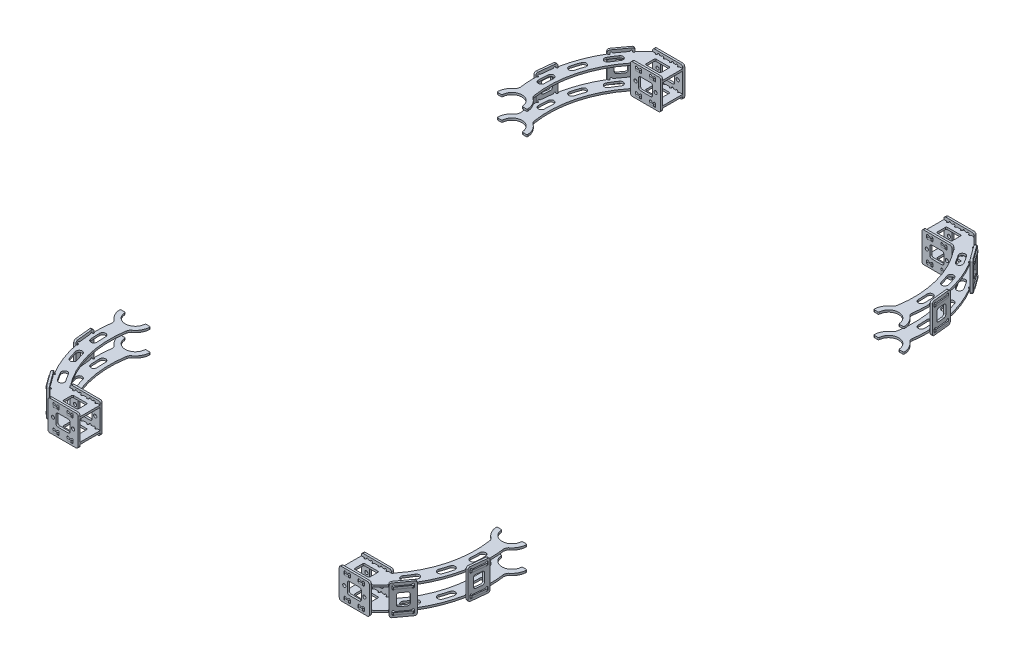
from build123d import *

# Parameters (mm, degrees)
EXTRUDE_START       = 10
SKETCH_1_W          = 15
SKETCH_1_H          = 10
EXTRUDE_1_DEPTH     = 2
SKETCH_2_R          = 1
CUT_EXTRUDE_1_DEPTH = 130.036816452
CHAMFER_1_SIZE      = 1
FILLET_1_R          = 5
FILLET_5_R          = 1
SKETCH_3_W          = 30
SKETCH_3_H          = 30
SKETCH_3_R          = 1.6
SKETCH_3_W_2        = 14
SKETCH_3_H_2        = 12
EXTRUDE_2_DEPTH     = 2
FILLET_2_R          = 2
EXTRUDE_START_2     = -1
SKETCH_4_W          = 20
SKETCH_4_H          = 30
SKETCH_4_W_2        = 10
SKETCH_4_H_2        = 12
EXTRUDE_3_DEPTH     = 2
FILLET_3_R          = 2
SKETCH_5_W          = 20
SKETCH_5_H          = 30
SKETCH_5_W_2        = 10
SKETCH_5_H_2        = 12
EXTRUDE_4_DEPTH     = 2
FILLET_4_R          = 2


with BuildPart() as part:
    # 草图1 → 凸台-拉伸1 (new body)
    with BuildSketch(Plane(origin=(0, 0, 0), x_dir=(1, 0, 0), z_dir=(0, 1, 0)).offset(EXTRUDE_START)):
        with BuildLine():
            Line((-27.5, -92.5), (-30.5, -92.5))
            ThreePointArc((-30.5, -92.5), (-31.5, -93.5), (-32.5, -92.5))
            Line((-32.5, -92.5), (-32.5, -89.5))
            Line((-32.5, -89.5), (-38.5, -89.5))
            Line((-38.5, -89.5), (-38.5, -92.5))
            ThreePointArc((-38.5, -92.5), (-39.5, -93.5), (-40.5, -92.5))
            Line((-40.5, -92.5), (-44.5, -92.5))
            ThreePointArc((-44.5, -92.5), (-45.5, -93.5), (-46.5, -92.5))
            Line((-46.5, -92.5), (-46.5, -89.5))
            Line((-46.5, -89.5), (-52.5, -89.5))
            Line((-52.5, -89.5), (-52.5, -92.5))
            ThreePointArc((-52.5, -92.5), (-53.5, -93.5), (-54.5, -92.5))
            Line((-54.5, -92.5), (-57.5, -92.5))
            Line((-57.5, -92.5), (-57.5, -112.5))
            Line((-57.5, -112.5), (-54.5, -112.5))
            ThreePointArc((-54.5, -112.5), (-53.5, -111.5), (-52.5, -112.5))
            Line((-52.5, -112.5), (-52.5, -115.5))
            Line((-52.5, -115.5), (-46.5, -115.5))
            Line((-46.5, -115.5), (-46.5, -112.5))
            ThreePointArc((-46.5, -112.5), (-45.5, -111.5), (-44.5, -112.5))
            Line((-44.5, -112.5), (-40.5, -112.5))
            ThreePointArc((-40.5, -112.5), (-39.5, -111.5), (-38.5, -112.5))
            Line((-38.5, -112.5), (-38.5, -115.5))
            Line((-38.5, -115.5), (-32.5, -115.5))
            Line((-32.5, -115.5), (-32.5, -112.5))
            ThreePointArc((-32.5, -112.5), (-31.5, -111.5), (-30.5, -112.5))
            Line((-30.5, -112.5), (-27.5, -112.5))
            ThreePointArc((-27.5, -112.5), (-23.120698186, -108.257925136), (-18.981512523, -103.781249407))
            ThreePointArc((-18.981512523, -103.781249407), (-19.109539683, -102.403659075), (-17.738715012, -102.216614162))
            Line((-17.738715012, -102.216614162), (-15.01528498, -104.195301902))
            Line((-15.01528498, -104.195301902), (-5.610720943, -91.251029992))
            Line((-5.610720943, -91.251029992), (-8.334150976, -89.272342252))
            ThreePointArc((-8.334150976, -89.272342252), (-8.579868811, -87.910810459), (-7.230139981, -87.6068727))
            ThreePointArc((-7.230139981, -87.6068727), (1.053453635, -70.555329514), (6.307253335, -52.340757409))
            ThreePointArc((6.307253335, -52.340757409), (5.507583396, -51.211742766), (6.601229928, -50.364344784))
            Line((6.601229928, -50.364344784), (9.949133391, -50.716223617))
            Line((9.949133391, -50.716223617), (11.621588804, -34.803873291))
            Line((11.621588804, -34.803873291), (8.27368534, -34.451994458))
            ThreePointArc((8.27368534, -34.451994458), (7.380121556, -33.395732255), (8.397052132, -32.457650019))
            ThreePointArc((8.397052132, -32.457650019), (8.11616167, -22.831672104), (7, -13.266499161))
            ThreePointArc((7, -13.266499161), (12.845232579, -7.745966692), (15, 0))
            Line((15, 0), (10, 0))
            ThreePointArc((10, 0), (0, -10), (-10, 0))
            Line((-10, 0), (-15, 0))
            ThreePointArc((-15, 0), (-12.845232579, -7.745966692), (-7, -13.266499161))
            ThreePointArc((-7, -13.266499161), (-8.478220219, -55.1527629), (-27.5, -92.5))
        make_face()
        with Locations((-42.5, -102.5)):
            Rectangle(SKETCH_1_W, SKETCH_1_H, mode=Mode.SUBTRACT)
    extrude(amount=EXTRUDE_1_DEPTH)

    # 草图2 → 切除-拉伸1 (cut, through all)
    with BuildSketch(Plane(origin=(0, 12, 0), x_dir=(1, 0, 0), z_dir=(0, 1, 0))):
        with Locations((-27.5, -91.5)):
            Circle(SKETCH_2_R)
        with BuildLine():
            ThreePointArc((4.26643825, -40.197188362), (4.571765263, -35.538798336), (4.673605554, -30.871523888))
            ThreePointArc((4.673605554, -30.871523888), (1.673605554, -27.871523888), (-1.326394446, -30.871523888))
            ThreePointArc((-1.326394446, -30.871523888), (-1.422524066, -35.277082012), (-1.710729939, -39.674253905))
            ThreePointArc((-1.710729939, -39.674253905), (1.016386927, -42.924305228), (4.26643825, -40.197188362))
        make_face()
        with BuildLine():
            ThreePointArc((-7.417439746, -65.415558364), (-6.00098242, -61.242809638), (-4.767885991, -57.012247443))
            ThreePointArc((-4.767885991, -57.012247443), (-1.093651376, -54.8909271), (1.027668967, -58.565161714))
            ThreePointArc((1.027668967, -58.565161714), (-0.278680716, -63.047044435), (-1.779284022, -67.467679224))
            ThreePointArc((-1.779284022, -67.467679224), (-5.624422314, -69.260696656), (-7.417439746, -65.415558364))
        make_face()
        with BuildLine():
            ThreePointArc((-19.592037973, -88.802743959), (-17.143858419, -85.138784331), (-14.857828664, -81.371523888))
            ThreePointArc((-14.857828664, -81.371523888), (-10.759752452, -80.273447677), (-9.661676241, -84.371523888))
            ThreePointArc((-9.661676241, -84.371523888), (-12.083509744, -88.362581981), (-14.677125707, -92.244202577))
            ThreePointArc((-14.677125707, -92.244202577), (-18.855311149, -92.980929401), (-19.592037973, -88.802743959))
        make_face()
    extrude(amount=-CUT_EXTRUDE_1_DEPTH, mode=Mode.SUBTRACT)

    # 倒角1
    chamfer_1_edges = [part.edges().sort_by_distance(p)[0] for p in [
        (11.621588804, 11, 34.803873291),
        (9.949133391, 11, 50.716223617),
        (-5.610720943, 11, 91.251029992),
        (-15.01528498, 11, 104.195301902),
        (-32.5, 11, 115.5),
        (-38.5, 11, 115.5),
        (-46.5, 11, 115.5),
        (-52.5, 11, 115.5),
        (-52.5, 11, 89.5),
        (-46.5, 11, 89.5),
        (-38.5, 11, 89.5),
        (-32.5, 11, 89.5),
    ]]
    chamfer(chamfer_1_edges, length=CHAMFER_1_SIZE)

    # 圆角1
    fillet_1_edges = [part.edges().sort_by_distance(p)[0] for p in [
        (-7, 11, 13.266499161),
        (7, 11, 13.266499161),
        (-27.5, 11, 112.5),
    ]]
    fillet(fillet_1_edges, radius=FILLET_1_R)

    # 圆角5
    fillet_5_edges = [part.edges().sort_by_distance(p)[0] for p in [
        (-35, 11, 107.5),
        (-35, 11, 97.5),
        (-50, 11, 97.5),
        (-50, 11, 107.5),
        (-15, 11, 0),
        (-10, 11, 0),
        (10, 11, 0),
        (15, 11, 0),
    ]]
    fillet(fillet_5_edges, radius=FILLET_5_R)


with BuildPart() as body_2:
    # 镜向1: mirrored copy
    add(part.part.mirror(Plane.ZX))


with BuildPart() as body_3:
    # 草图3 → 凸台-拉伸2 (new body)
    with BuildSketch(Plane.XY.offset(112.5)):
        with Locations((-42.5, 0)):
            Rectangle(SKETCH_3_W, SKETCH_3_H)
        with Locations((-52.5, 0)):
            Circle(SKETCH_3_R, mode=Mode.SUBTRACT)
        with Locations(Location((-32.5, 0, 0), (0, 0, 180))):
            Circle(SKETCH_3_R, mode=Mode.SUBTRACT)
        with BuildLine():
            Line((-50.6, 12.1), (-48.4, 12.1))
            ThreePointArc((-48.4, 12.1), (-47.4, 13.1), (-46.4, 12.1))
            Line((-46.4, 12.1), (-46.4, 9.9))
            ThreePointArc((-46.4, 9.9), (-47.4, 8.9), (-48.4, 9.9))
            Line((-48.4, 9.9), (-50.6, 9.9))
            ThreePointArc((-50.6, 9.9), (-51.6, 8.9), (-52.6, 9.9))
            Line((-52.6, 9.9), (-52.6, 12.1))
            ThreePointArc((-52.6, 12.1), (-51.6, 13.1), (-50.6, 12.1))
        make_face(mode=Mode.SUBTRACT)
        with BuildLine():
            Line((-32.4, 12.1), (-32.4, 9.9))
            ThreePointArc((-32.4, 9.9), (-33.4, 8.9), (-34.4, 9.9))
            Line((-34.4, 9.9), (-36.6, 9.9))
            ThreePointArc((-36.6, 9.9), (-37.6, 8.9), (-38.6, 9.9))
            Line((-38.6, 9.9), (-38.6, 12.1))
            ThreePointArc((-38.6, 12.1), (-37.6, 13.1), (-36.6, 12.1))
            Line((-36.6, 12.1), (-34.4, 12.1))
            ThreePointArc((-34.4, 12.1), (-33.4, 13.1), (-32.4, 12.1))
        make_face(mode=Mode.SUBTRACT)
        with BuildLine():
            Line((-34.4, -9.9), (-36.6, -9.9))
            ThreePointArc((-36.6, -9.9), (-37.6, -8.9), (-38.6, -9.9))
            Line((-38.6, -9.9), (-38.6, -12.1))
            ThreePointArc((-38.6, -12.1), (-37.6, -13.1), (-36.6, -12.1))
            Line((-36.6, -12.1), (-34.4, -12.1))
            ThreePointArc((-34.4, -12.1), (-33.4, -13.1), (-32.4, -12.1))
            Line((-32.4, -12.1), (-32.4, -9.9))
            ThreePointArc((-32.4, -9.9), (-33.4, -8.9), (-34.4, -9.9))
        make_face(mode=Mode.SUBTRACT)
        with BuildLine():
            Line((-46.4, -12.1), (-46.4, -9.9))
            ThreePointArc((-46.4, -9.9), (-47.4, -8.9), (-48.4, -9.9))
            Line((-48.4, -9.9), (-50.6, -9.9))
            ThreePointArc((-50.6, -9.9), (-51.6, -8.9), (-52.6, -9.9))
            Line((-52.6, -9.9), (-52.6, -12.1))
            ThreePointArc((-52.6, -12.1), (-51.6, -13.1), (-50.6, -12.1))
            Line((-50.6, -12.1), (-48.4, -12.1))
            ThreePointArc((-48.4, -12.1), (-47.4, -13.1), (-46.4, -12.1))
        make_face(mode=Mode.SUBTRACT)
        with Locations((-42.5, 0)):
            Rectangle(SKETCH_3_W_2, SKETCH_3_H_2, mode=Mode.SUBTRACT)
    extrude(amount=EXTRUDE_2_DEPTH)

    # 圆角2
    fillet_2_edges = [body_3.edges().sort_by_distance(p)[0] for p in [
        (-35.5, -6, 113.5),
        (-35.5, 6, 113.5),
        (-49.5, 6, 113.5),
        (-49.5, -6, 113.5),
        (-27.5, -15, 113.5),
        (-57.5, -15, 113.5),
        (-57.5, 15, 113.5),
        (-27.5, 15, 113.5),
    ]]
    fillet(fillet_2_edges, radius=FILLET_2_R)


with BuildPart() as body_4:
    # 镜向2: mirrored copy
    add(body_3.part.mirror(Plane.XY.offset(102.5)))


with BuildPart() as body_5:
    # 草图4 → 凸台-拉伸3 (new body)
    with BuildSketch(Plane(origin=(39.720178814, 0, 28.858399128), x_dir=(0.5877852522924745, 0, -0.8090169943749466), z_dir=(0.8090169943749465, 0, 0.5877852522924744)).offset(EXTRUDE_START_2)):
        with Locations((-85.121533043, 0)):
            Rectangle(SKETCH_4_W, SKETCH_4_H)
        with BuildLine():
            Line((-93.221533043, -12.1), (-93.221533043, -9.9))
            ThreePointArc((-93.221533043, -9.9), (-92.221533043, -8.9), (-91.221533043, -9.9))
            Line((-91.221533043, -9.9), (-79.021533043, -9.9))
            ThreePointArc((-79.021533043, -9.9), (-78.021533043, -8.9), (-77.021533043, -9.9))
            Line((-77.021533043, -9.9), (-77.021533043, -12.1))
            ThreePointArc((-77.021533043, -12.1), (-78.021533043, -13.1), (-79.021533043, -12.1))
            Line((-79.021533043, -12.1), (-91.221533043, -12.1))
            ThreePointArc((-91.221533043, -12.1), (-92.221533043, -13.1), (-93.221533043, -12.1))
        make_face(mode=Mode.SUBTRACT)
        with BuildLine():
            Line((-91.221533043, 12.1), (-79.021533043, 12.1))
            ThreePointArc((-79.021533043, 12.1), (-78.021533043, 13.1), (-77.021533043, 12.1))
            Line((-77.021533043, 12.1), (-77.021533043, 9.9))
            ThreePointArc((-77.021533043, 9.9), (-78.021533043, 8.9), (-79.021533043, 9.9))
            Line((-79.021533043, 9.9), (-91.221533043, 9.9))
            ThreePointArc((-91.221533043, 9.9), (-92.221533043, 8.9), (-93.221533043, 9.9))
            Line((-93.221533043, 9.9), (-93.221533043, 12.1))
            ThreePointArc((-93.221533043, 12.1), (-92.221533043, 13.1), (-91.221533043, 12.1))
        make_face(mode=Mode.SUBTRACT)
        with Locations((-85.121533043, 0)):
            Rectangle(SKETCH_4_W_2, SKETCH_4_H_2, mode=Mode.SUBTRACT)
    extrude(amount=-EXTRUDE_3_DEPTH)

    # 圆角3
    fillet_3_edges = [body_5.edges().sort_by_distance(p)[0] for p in [
        (-8.992110689, 6, 92.502510471),
        (-8.992110689, -6, 92.502510471),
        (-14.869963212, -6, 100.592680414),
        (-14.869963212, 6, 100.592680414),
        (-6.053184428, -15, 88.457425499),
        (-17.808889473, -15, 104.637765386),
        (-17.808889473, 15, 104.637765386),
        (-6.053184428, 15, 88.457425499),
    ]]
    fillet(fillet_3_edges, radius=FILLET_3_R)


with BuildPart() as body_6:
    # 草图5 → 凸台-拉伸4 (new body)
    with BuildSketch(Plane(origin=(15.112675076, 0, 1.588406157), x_dir=(0.10452846326765368, 0, -0.9945218953682733), z_dir=(0.9945218953682733, 0, 0.10452846326765368)).offset(EXTRUDE_START_2)):
        with Locations((-41.398427213, 0)):
            Rectangle(SKETCH_5_W, SKETCH_5_H)
        with BuildLine():
            Line((-47.498427213, 12.1), (-35.298427213, 12.1))
            ThreePointArc((-35.298427213, 12.1), (-34.298427213, 13.1), (-33.298427213, 12.1))
            Line((-33.298427213, 12.1), (-33.298427213, 9.9))
            ThreePointArc((-33.298427213, 9.9), (-34.298427213, 8.9), (-35.298427213, 9.9))
            Line((-35.298427213, 9.9), (-47.498427213, 9.9))
            ThreePointArc((-47.498427213, 9.9), (-48.498427213, 8.9), (-49.498427213, 9.9))
            Line((-49.498427213, 9.9), (-49.498427213, 12.1))
            ThreePointArc((-49.498427213, 12.1), (-48.498427213, 13.1), (-47.498427213, 12.1))
        make_face(mode=Mode.SUBTRACT)
        with BuildLine():
            Line((-49.498427213, -12.1), (-49.498427213, -9.9))
            ThreePointArc((-49.498427213, -9.9), (-48.498427213, -8.9), (-47.498427213, -9.9))
            Line((-47.498427213, -9.9), (-35.298427213, -9.9))
            ThreePointArc((-35.298427213, -9.9), (-34.298427213, -8.9), (-33.298427213, -9.9))
            Line((-33.298427213, -9.9), (-33.298427213, -12.1))
            ThreePointArc((-33.298427213, -12.1), (-34.298427213, -13.1), (-35.298427213, -12.1))
            Line((-35.298427213, -12.1), (-47.498427213, -12.1))
            ThreePointArc((-47.498427213, -12.1), (-48.498427213, -13.1), (-49.498427213, -12.1))
        make_face(mode=Mode.SUBTRACT)
        with Locations((-41.398427213, 0)):
            Rectangle(SKETCH_5_W_2, SKETCH_5_H_2, mode=Mode.SUBTRACT)
    extrude(amount=-EXTRUDE_4_DEPTH)

    # 圆角4
    fillet_4_edges = [body_6.edges().sort_by_distance(p)[0] for p in [
        (9.318959623, 6, 37.57838205),
        (9.318959623, -6, 37.57838205),
        (8.27367499, -6, 47.523601004),
        (8.27367499, 6, 47.523601004),
        (9.841601939, -15, 32.605772574),
        (7.751032674, -15, 52.496210481),
        (7.751032674, 15, 52.496210481),
        (9.841601939, 15, 32.605772574),
    ]]
    fillet(fillet_4_edges, radius=FILLET_4_R)


with BuildPart() as body_7:
    # 镜向3: mirrored copy
    add(part.part.mirror(Plane.ZY.offset(187.5)))


with BuildPart() as body_8:
    # Mirror 3 2: mirrored copy
    add(body_2.part.mirror(Plane.ZY.offset(187.5)))


with BuildPart() as body_9:
    # Mirror 3 3: mirrored copy
    add(body_3.part.mirror(Plane.ZY.offset(187.5)))


with BuildPart() as body_10:
    # Mirror 3 4: mirrored copy
    add(body_4.part.mirror(Plane.ZY.offset(187.5)))


with BuildPart() as body_11:
    # Mirror 3 5: mirrored copy
    add(body_5.part.mirror(Plane.ZY.offset(187.5)))


with BuildPart() as body_12:
    # Mirror 3 6: mirrored copy
    add(body_6.part.mirror(Plane.ZY.offset(187.5)))


with BuildPart() as body_13:
    # 镜向4: mirrored copy
    add(body_9.part.mirror(Plane(origin=(0, 0, -187.5), x_dir=(1, 0, 0), z_dir=(0, 0, -1))))


with BuildPart() as body_14:
    # Mirror 4 2: mirrored copy
    add(body_12.part.mirror(Plane(origin=(0, 0, -187.5), x_dir=(1, 0, 0), z_dir=(0, 0, -1))))


with BuildPart() as body_15:
    # Mirror 4 3: mirrored copy
    add(body_5.part.mirror(Plane(origin=(0, 0, -187.5), x_dir=(1, 0, 0), z_dir=(0, 0, -1))))


with BuildPart() as body_16:
    # Mirror 4 4: mirrored copy
    add(body_4.part.mirror(Plane(origin=(0, 0, -187.5), x_dir=(1, 0, 0), z_dir=(0, 0, -1))))


with BuildPart() as body_17:
    # Mirror 4 5: mirrored copy
    add(body_8.part.mirror(Plane(origin=(0, 0, -187.5), x_dir=(1, 0, 0), z_dir=(0, 0, -1))))


with BuildPart() as body_18:
    # Mirror 4 6: mirrored copy
    add(body_7.part.mirror(Plane(origin=(0, 0, -187.5), x_dir=(1, 0, 0), z_dir=(0, 0, -1))))


with BuildPart() as body_19:
    # Mirror 4 7: mirrored copy
    add(body_10.part.mirror(Plane(origin=(0, 0, -187.5), x_dir=(1, 0, 0), z_dir=(0, 0, -1))))


with BuildPart() as body_20:
    # Mirror 4 8: mirrored copy
    add(body_2.part.mirror(Plane(origin=(0, 0, -187.5), x_dir=(1, 0, 0), z_dir=(0, 0, -1))))


with BuildPart() as body_21:
    # Mirror 4 9: mirrored copy
    add(part.part.mirror(Plane(origin=(0, 0, -187.5), x_dir=(1, 0, 0), z_dir=(0, 0, -1))))


with BuildPart() as body_22:
    # Mirror 4 10: mirrored copy
    add(body_11.part.mirror(Plane(origin=(0, 0, -187.5), x_dir=(1, 0, 0), z_dir=(0, 0, -1))))


with BuildPart() as body_23:
    # Mirror 4 11: mirrored copy
    add(body_3.part.mirror(Plane(origin=(0, 0, -187.5), x_dir=(1, 0, 0), z_dir=(0, 0, -1))))


with BuildPart() as body_24:
    # Mirror 4 12: mirrored copy
    add(body_6.part.mirror(Plane(origin=(0, 0, -187.5), x_dir=(1, 0, 0), z_dir=(0, 0, -1))))


solid = Compound([part.part, body_2.part, body_3.part, body_4.part, body_5.part, body_6.part, body_7.part, body_8.part, body_9.part, body_10.part, body_11.part, body_12.part, body_13.part, body_14.part, body_15.part, body_16.part, body_17.part, body_18.part, body_19.part, body_20.part, body_21.part, body_22.part, body_23.part, body_24.part])
